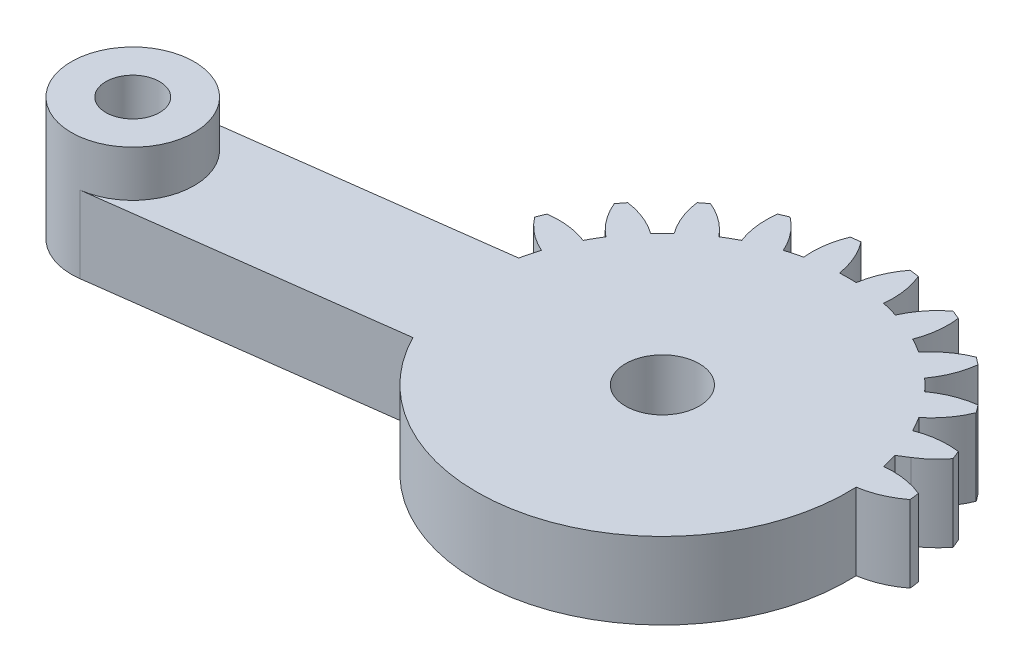
from build123d import *

# Parameters (mm, degrees)
SKETCH1_R           = 1.75
SKETCH1_R_2         = 2.4
BOSS_EXTRUDE1_DEPTH = 5
EXTRUDE_START       = 3
SKETCH_1_R          = 4
SKETCH_1_R_2        = 1.75
EXTRUDE_1_DEPTH     = 3


with BuildPart() as part:
    # Sketch1 → Boss-Extrude1 (new body)
    with BuildSketch(Plane(origin=(0, 4, 0), x_dir=(1, 0, 0), z_dir=(0, 1, 0))):
        with BuildLine():
            Line((1.43808022, 3.600125745), (2.081641936, 4))
            ThreePointArc((2.081641936, 4), (2.861028333, 4.588201733), (3.521749436, 5.30713988))
            ThreePointArc((3.521749436, 5.30713988), (3.405395609, 5.596745198), (3.282888305, 5.883801663))
            ThreePointArc((3.282888305, 5.883801663), (1.93527598, 5.894040025), (0.627094961, 5.57027124))
            ThreePointArc((0.627094961, 5.57027124), (0.366286148, 6.046375), (0.084372603, 6.510293938))
            ThreePointArc((0.084372603, 6.510293938), (1.018855105, 7.48132754), (1.683794586, 8.65351323))
            ThreePointArc((1.683794586, 8.65351323), (1.496450048, 8.903135899), (1.303821399, 9.148703928))
            ThreePointArc((1.303821399, 9.148703928), (-0.000522033, 8.809805691), (-1.180330337, 8.158486898))
            ThreePointArc((-1.180330337, 8.158486898), (-1.555477026, 8.550865528), (-1.947855656, 8.926012217))
            ThreePointArc((-1.947855656, 8.926012217), (-1.296536862, 10.105820521), (-0.957638625, 11.410163953))
            ThreePointArc((-0.957638625, 11.410163953), (-1.203206655, 11.602792602), (-1.452829324, 11.79013714))
            ThreePointArc((-1.452829324, 11.79013714), (-2.625015014, 11.125197659), (-3.596048616, 10.190715157))
            ThreePointArc((-3.596048616, 10.190715157), (-4.059967554, 10.472628702), (-4.536071314, 10.733437515))
            ThreePointArc((-4.536071314, 10.733437515), (-4.212302529, 12.041618533), (-4.222540891, 13.389230859))
            ThreePointArc((-4.222540891, 13.389230859), (-4.509597355, 13.511738163), (-4.799202674, 13.62809199))
            ThreePointArc((-4.799202674, 13.62809199), (-5.759348103, 12.682425791), (-6.455432668, 11.528463019))
            ThreePointArc((-6.455432668, 11.528463019), (-6.976508546, 11.680699536), (-7.503891752, 11.809396783))
            ThreePointArc((-7.503891752, 11.809396783), (-7.529737283, 13.156800143), (-7.888414517, 14.455843809))
            ThreePointArc((-7.888414517, 14.455843809), (-8.197396993, 14.499881098), (-8.507248835, 14.537314892))
            ThreePointArc((-8.507248835, 14.537314892), (-9.18992168, 13.375367565), (-9.563620196, 12.080565177))
            ThreePointArc((-9.563620196, 12.080565177), (-10.106342554, 12.09275), (-10.649064912, 12.080565177))
            ThreePointArc((-10.649064912, 12.080565177), (-11.022763428, 13.375367565), (-11.705436272, 14.537314892))
            ThreePointArc((-11.705436272, 14.537314892), (-12.015288115, 14.499881098), (-12.324270591, 14.455843809))
            ThreePointArc((-12.324270591, 14.455843809), (-12.682947825, 13.156800143), (-12.708793355, 11.809396783))
            ThreePointArc((-12.708793355, 11.809396783), (-13.236176561, 11.680699536), (-13.757252439, 11.528463019))
            ThreePointArc((-13.757252439, 11.528463019), (-14.453337005, 12.682425791), (-15.413482434, 13.62809199))
            ThreePointArc((-15.413482434, 13.62809199), (-15.703087752, 13.511738163), (-15.990144217, 13.389230859))
            ThreePointArc((-15.990144217, 13.389230859), (-16.000382579, 12.041618533), (-15.676613793, 10.733437515))
            ThreePointArc((-15.676613793, 10.733437515), (-16.152717554, 10.472628702), (-16.616636492, 10.190715157))
            ThreePointArc((-16.616636492, 10.190715157), (-17.587670094, 11.125197659), (-18.759855783, 11.79013714))
            ThreePointArc((-18.759855783, 11.79013714), (-19.009478453, 11.602792602), (-19.255046482, 11.410163953))
            ThreePointArc((-19.255046482, 11.410163953), (-18.916148245, 10.105820521), (-18.264829452, 8.926012217))
            ThreePointArc((-18.264829452, 8.926012217), (-18.657208082, 8.550865528), (-19.032354771, 8.158486898))
            ThreePointArc((-19.032354771, 8.158486898), (-20.212163074, 8.809805691), (-21.516506507, 9.148703928))
            ThreePointArc((-21.516506507, 9.148703928), (-21.709135156, 8.903135899), (-21.896479694, 8.65351323))
            ThreePointArc((-21.896479694, 8.65351323), (-21.231540213, 7.48132754), (-20.297057711, 6.510293938))
            ThreePointArc((-20.297057711, 6.510293938), (-20.578971255, 6.046375), (-20.839780068, 5.57027124))
            ThreePointArc((-20.839780068, 5.57027124), (-22.147961087, 5.894040025), (-23.495573413, 5.883801663))
            ThreePointArc((-23.495573413, 5.883801663), (-23.618080717, 5.596745198), (-23.734434544, 5.30713988))
            ThreePointArc((-23.734434544, 5.30713988), (-22.788768345, 4.346994451), (-21.634805572, 3.650909885))
            ThreePointArc((-21.634805572, 3.650909885), (-21.803584999, 3.067429176), (-21.942853375, 2.47620963))
            Line((-21.942853375, 2.47620963), (-41.11537681, -0.047900965))
            ThreePointArc((-41.11537681, -0.047900965), (-44.559051487, -4.53578518), (-40.071167272, -7.979459856))
            Line((-40.071167272, -7.979459856), (-20.898643838, -5.455349261))
            ThreePointArc((-20.898643838, -5.455349261), (-7.038913378, -11.697242445), (1.974222624, 0.542722358))
            ThreePointArc((1.974222624, 0.542722358), (3.269025011, 0.916420874), (4.430972339, 1.599093719))
            ThreePointArc((4.430972339, 1.599093719), (4.393538544, 1.908945561), (4.349501255, 2.217928037))
            ThreePointArc((4.349501255, 2.217928037), (3.050457589, 2.576605271), (1.70305423, 2.602450802))
            ThreePointArc((1.70305423, 2.602450802), (1.581217534, 3.104116905), (1.43808022, 3.600125745))
        make_face()
        with Locations(Location((-40.593272041, -4.013680411, 0), (0, 0, 90))):
            Circle(SKETCH1_R, mode=Mode.SUBTRACT)
        with Locations(Location((-10.106342554, 0, 0), (0, 0, 90))):
            Circle(SKETCH1_R_2, mode=Mode.SUBTRACT)
    extrude(amount=-BOSS_EXTRUDE1_DEPTH)

    # 草图1 → 凸台-拉伸1 (add)
    with BuildSketch(Plane(origin=(0, 4, 0), x_dir=(1, 0, 0), z_dir=(0, 1, 0)).offset(EXTRUDE_START)):
        with Locations(Location((-40.593272041, -4.013680411, 0), (0, 0, 270))):
            Circle(SKETCH_1_R)
        with Locations(Location((-40.593272041, -4.013680411, 0), (0, 0, 270))):
            Circle(SKETCH_1_R_2, mode=Mode.SUBTRACT)
    extrude(amount=-EXTRUDE_1_DEPTH)


solid = part.part
